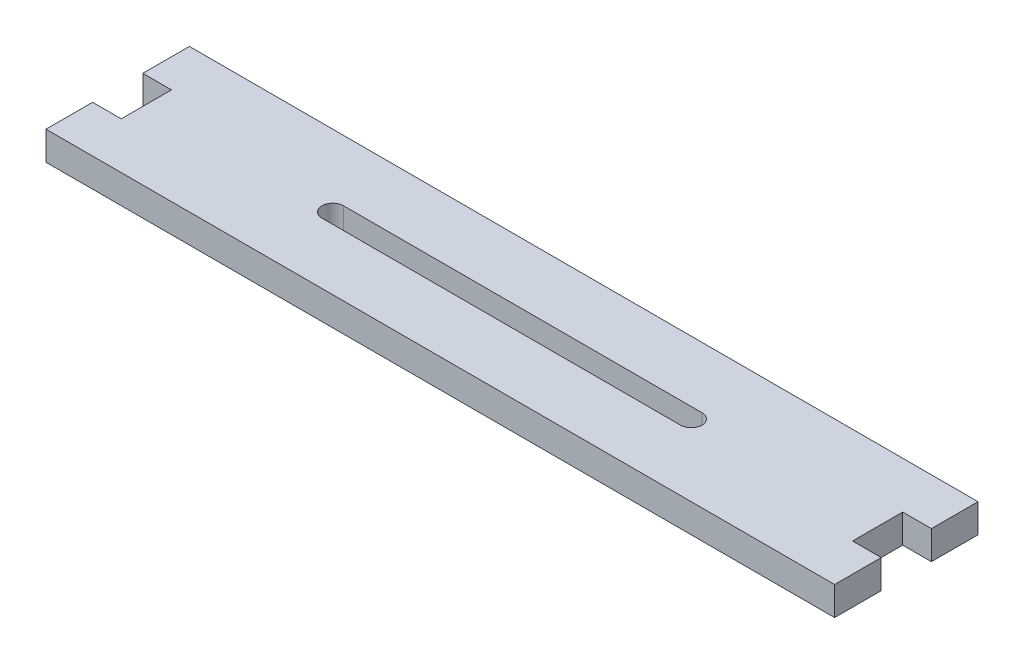
from build123d import *

# Parameters (mm, degrees)
BOSS_EXTRUDE1_DEPTH = 4
SKETCH2_R           = 1.5
CUT_EXTRUDE2_DEPTH  = 4


with BuildPart() as part:
    # Sketch1 → Boss-Extrude1 (new body)
    with BuildSketch(Plane(origin=(0, 0, 0), x_dir=(1, 0, 0), z_dir=(0, 1, 0))):
        Polygon((55, 10), (-55, 10), (-55, 3.5), (-51, 3.5), (-51, -3.5), (-55, -3.5), (-55, -10), (55, -10), (55, -3.5), (51, -3.5), (51, 3.5), (55, 3.5), align=None)
    extrude(amount=BOSS_EXTRUDE1_DEPTH)

    # Sketch2 → Cut-Extrude2 (cut)
    with BuildSketch(Plane.XZ):
        with BuildLine():
            ThreePointArc((-23.5, 0), (-23.939339828, -1.060660172), (-25, -1.5))
            Line((-25, -1.5), (25, -1.5))
            ThreePointArc((25, -1.5), (23.5, 0), (25, 1.5))
            Line((25, 1.5), (-25, 1.5))
            ThreePointArc((-25, 1.5), (-23.939339828, 1.060660172), (-23.5, 0))
        make_face()
        with Locations((-25, 0)):
            Circle(SKETCH2_R)
        with Locations((25, 0)):
            Circle(SKETCH2_R)
    extrude(amount=-CUT_EXTRUDE2_DEPTH, mode=Mode.SUBTRACT)


solid = part.part
